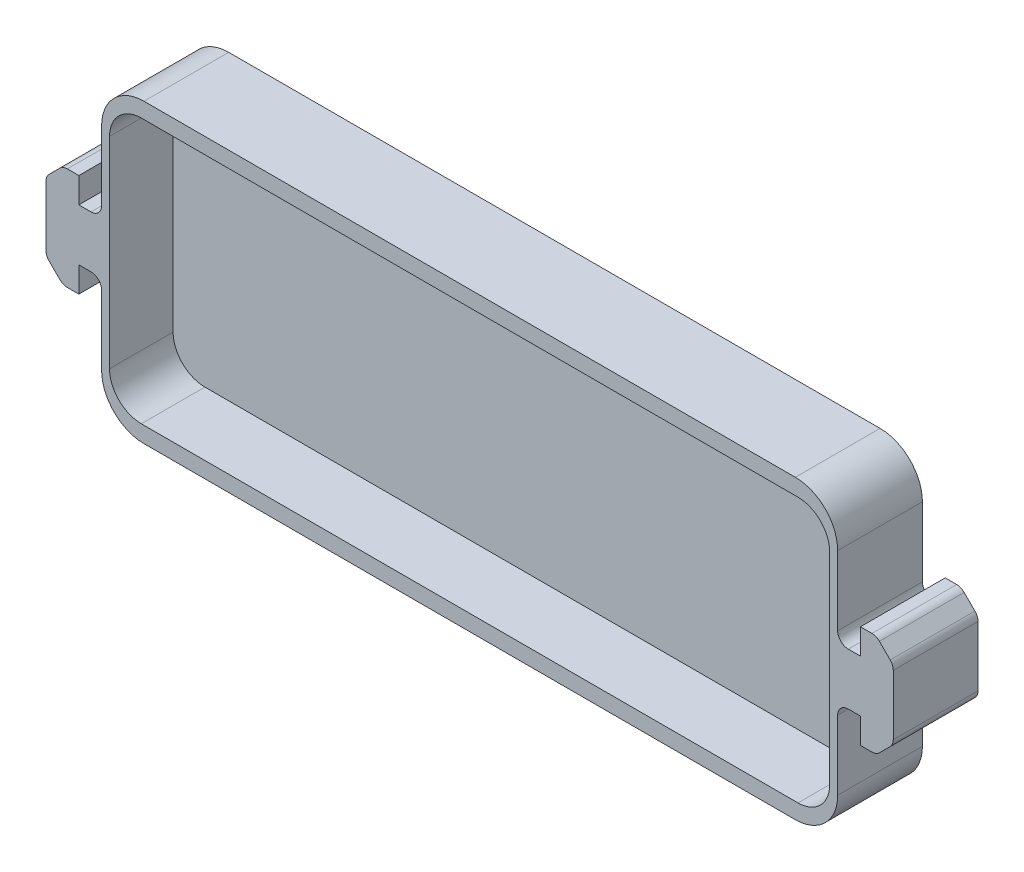
from build123d import *

# Parameters (mm, degrees)
ESQUISSE1_W             = 34.75
ESQUISSE1_H             = 28
BOSS_EXTRU_1_DEPTH      = 8
CONG_1_R                = 4
ENL_V_MAT_EXTRU_1_DEPTH = 6
BOSS_EXTRU_2_DEPTH      = 8
CONG_2_R                = 1
CONG_1_OF_SYM_TRIE1_R   = 4
CONG_2_OF_SYM_TRIE1_R   = 1


with BuildPart() as part:
    # Esquisse1 → Boss.-Extru.1 (new body)
    with BuildSketch(Plane.XY):
        with Locations((-17.375, 0)):
            Rectangle(ESQUISSE1_W, ESQUISSE1_H)
    boss_extru_1 = extrude(amount=BOSS_EXTRU_1_DEPTH)

    # Congé1
    cong_1_edges = [part.edges().sort_by_distance(p)[0] for p in [
        (-34.75, -14, 4),
        (-34.75, 14, 4),
    ]]
    fillet(cong_1_edges, radius=CONG_1_R)

    # Esquisse3 → Enlèv. mat.-Extru.1 (cut)
    with BuildSketch(Plane.XY.offset(8)):
        with BuildLine():
            Line((0, -12.5), (0, 12.5))
            Line((0, 12.5), (-31, 12.5))
            ThreePointArc((-31, 12.5), (-33.121320344, 11.621320344), (-34, 9.5))
            Line((-34, 9.5), (-34, -9.5))
            ThreePointArc((-34, -9.5), (-33.121320344, -11.621320344), (-31, -12.5))
            Line((-31, -12.5), (0, -12.5))
        make_face()
    enl_v_mat_extru_1 = extrude(amount=-ENL_V_MAT_EXTRU_1_DEPTH, mode=Mode.SUBTRACT)

    # Esquisse5 → Boss.-Extru.2 (add)
    with BuildSketch(Plane.XY):
        Polygon((-34.75, 2.45), (-36.9, 2.45), (-36.9, 4.85), (-38.4, 4.85), (-40, 3.25), (-40, -3.25), (-38.4, -4.85), (-36.9, -4.85), (-36.9, -2.45), (-34.75, -2.45), align=None)
    boss_extru_2 = extrude(amount=BOSS_EXTRU_2_DEPTH)

    # Congé2
    cong_2_edges = [part.edges().sort_by_distance(p)[0] for p in [
        (-38.4, -4.85, 4),
        (-40, -3.25, 4),
        (-40, 3.25, 4),
        (-38.4, 4.85, 4),
        (-34.75, 2.45, 4),
        (-34.75, -2.45, 4),
    ]]
    fillet(cong_2_edges, radius=CONG_2_R)

    # Symétrie1: Boss.-Extru.1, Enlèv. mat.-Extru.1, Boss.-Extru.2 across plane
    add(boss_extru_1.mirror(Plane(origin=(0, -14, 8), x_dir=(0, 0, 1), z_dir=(-1, 0, 0))))
    add(enl_v_mat_extru_1.mirror(Plane(origin=(0, -14, 8), x_dir=(0, 0, 1), z_dir=(-1, 0, 0))), mode=Mode.SUBTRACT)
    add(boss_extru_2.mirror(Plane(origin=(0, -14, 8), x_dir=(0, 0, 1), z_dir=(-1, 0, 0))))

    # Congé1 of Symétrie1
    cong_1_of_sym_trie1_edges = [part.edges().sort_by_distance(p)[0] for p in [
        (34.75, -14, 4),
        (34.75, 14, 4),
    ]]
    fillet(cong_1_of_sym_trie1_edges, radius=CONG_1_OF_SYM_TRIE1_R)

    # Congé2 of Symétrie1
    cong_2_of_sym_trie1_edges = [part.edges().sort_by_distance(p)[0] for p in [
        (38.4, -4.85, 4),
        (40, -3.25, 4),
        (40, 3.25, 4),
        (38.4, 4.85, 4),
        (34.75, 2.45, 4),
        (34.75, -2.45, 4),
    ]]
    fillet(cong_2_of_sym_trie1_edges, radius=CONG_2_OF_SYM_TRIE1_R)


solid = part.part
